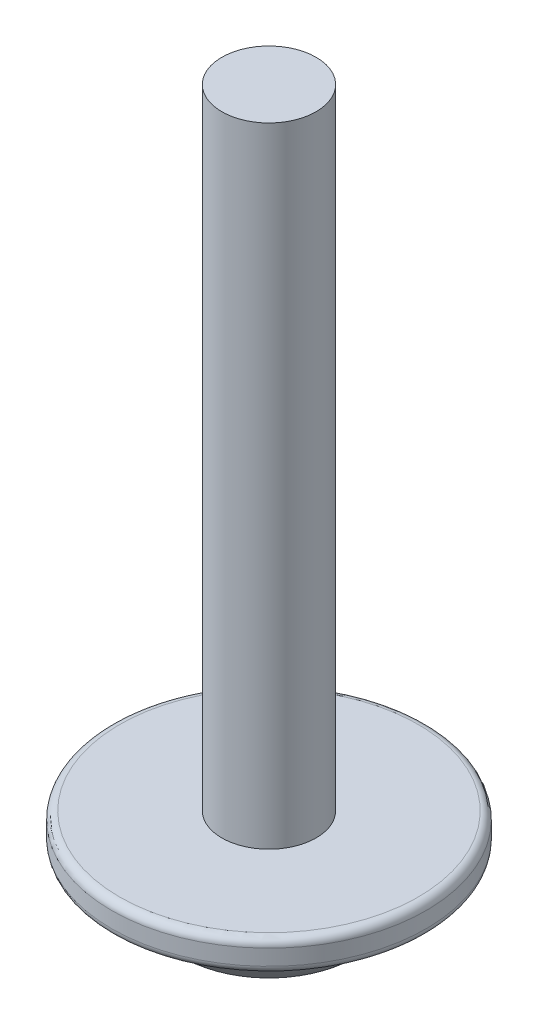
from build123d import *

# Parameters (mm, degrees)
SKETCH1_W          = 40
SKETCH1_H          = 3
CUT_EXTRUDE1_START = 1
CUT_EXTRUDE1_DEPTH = 10
FILLET1_R          = 0.5


with BuildPart() as part:
    # Sketch1 → Revolve1 (revolve)
    with BuildSketch(Plane.YZ, mode=Mode.PRIVATE) as revolve1_sk:
        with BuildLine():
            Line((-7, 0), (-2, 0))
            Line((-2, 0), (-2, 8))
            ThreePointArc((-2, 8), (-5.804709846, 4.815443654), (-7, 0))
        make_face()
        Polygon((0, 10), (0, 3), (0, 0), (-2, 0), (-2, 10), align=None)
        with Locations((20, 1.5)):
            Rectangle(SKETCH1_W, SKETCH1_H)
    revolve(revolve1_sk.sketch.rotate(Axis((0, -21.912032937, 0), (0, 1, 0)), 180), axis=Axis((0, -21.912032937, 0), (0, 1, 0)))

    # Sketch2 → Cut-Extrude1 (cut)
    with BuildSketch(Plane.XZ.offset(2).offset(CUT_EXTRUDE1_START)):
        Polygon((2, -3.464101615), (4, 0), (2, 3.464101615), (-2, 3.464101615), (-4, 0), (-2, -3.464101615), align=None)
    extrude(amount=CUT_EXTRUDE1_DEPTH, mode=Mode.SUBTRACT)

    # Fillet1
    fillet1_edges = [part.edges().sort_by_distance(p)[0] for p in [
        (-3, -6.480998487, -1.732050808),
        (-3, -6.480998487, 1.732050808),
        (0, -6.480998487, 3.464101615),
        (3, -6.480998487, 1.732050808),
        (3, -6.480998487, -1.732050808),
        (-1.006711024, -6.423910627, -3.464101615),
        (-2, -4.625346904, -3.464101615),
        (0, -3, -3.464101615),
        (2, -4.625346904, -3.464101615),
        (3, -3, -1.732050808),
        (4, -4.625346904, 0),
        (3, -3, 1.732050808),
        (2, -4.625346904, 3.464101615),
        (0, -3, 3.464101615),
        (-2, -4.625346904, 3.464101615),
        (-3, -3, 1.732050808),
        (-4, -4.625346904, 0),
        (-3, -3, -1.732050808),
        (0, -2, 10),
        (0, 0, 10),
    ]]
    fillet(fillet1_edges, radius=FILLET1_R)


solid = part.part
